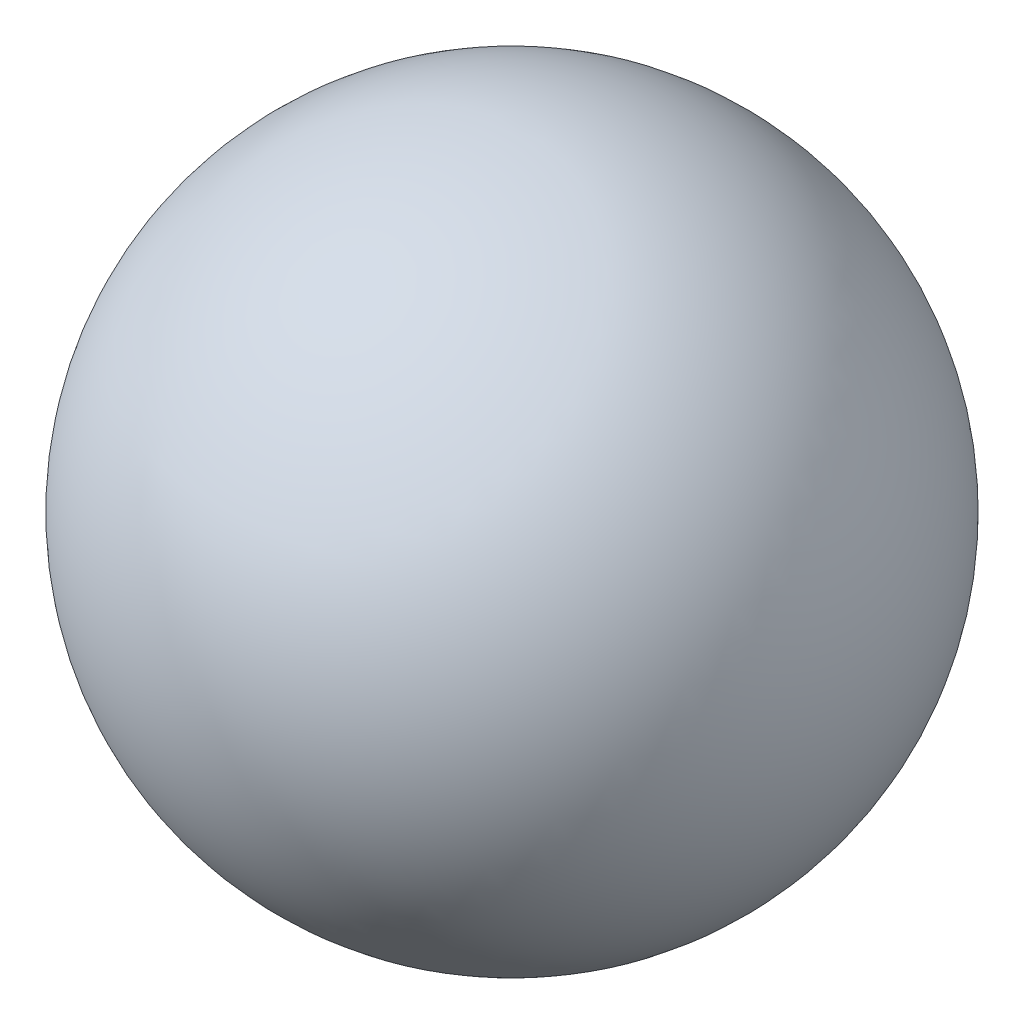
from build123d import *


with BuildPart() as part:
    # Sketch1 → Revolve1 (revolve)
    with BuildSketch(Plane.XY):
        with BuildLine():
            Line((0, -1.75), (0, 1.75))
            ThreePointArc((0, 1.75), (-1.75, 0), (0, -1.75))
        make_face()
    revolve(axis=Axis((0, -1.75, 0), (0, 1, 0)))


solid = part.part
